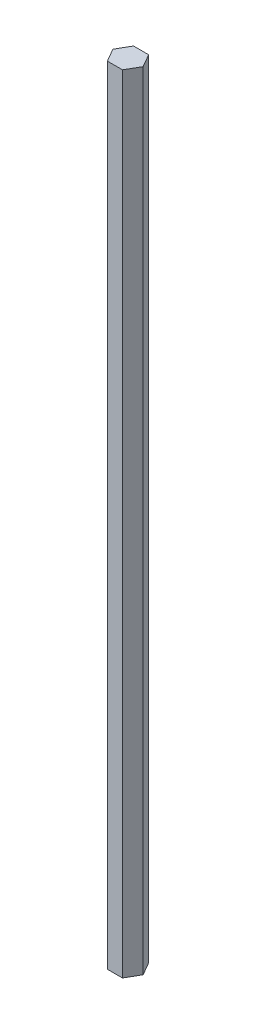
from build123d import *

# Parameters (mm, degrees)
EXTRUDE_1_DEPTH = 250


with BuildPart() as part:
    # 草图1 → 凸台-拉伸1 (new body)
    with BuildSketch(Plane(origin=(0, 0, 0), x_dir=(1, 0, 0), z_dir=(0, 1, 0))):
        Polygon((4.8, 0), (2.4, 4.156921938), (-2.4, 4.156921938), (-4.8, 0), (-2.4, -4.156921938), (2.4, -4.156921938), align=None)
    extrude(amount=EXTRUDE_1_DEPTH)


solid = part.part
